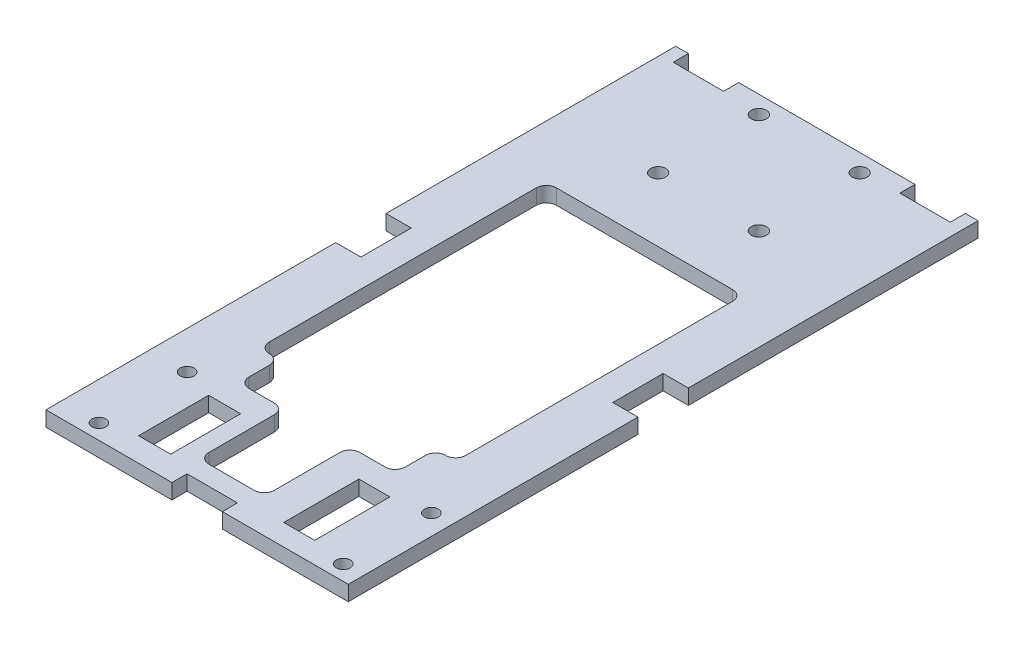
from build123d import *

# Parameters (mm, degrees)
CROQUIS1_R              = 1.5
CROQUIS1_R_2            = 1.375
CROQUIS1_W              = 6.357227068
CROQUIS1_H              = 13.910539406
CROQUIS1_W_2            = 6.149922685
CROQUIS1_H_2            = 14.93552652
SALIENTE_EXTRUIR1_DEPTH = 3


with BuildPart() as part:
    # Croquis1 → Saliente-Extruir1 (new body)
    with BuildSketch(Plane(origin=(0, 0, 0), x_dir=(1, 0, 0), z_dir=(0, 1, 0))):
        Polygon((0, 0), (25, 0), (25, 3), (35, 3), (35, 0), (60, 0), (60, 57.5), (55, 57.5), (55, 67.5), (60, 67.5), (60, 125), (57.5, 125), (57.5, 122), (47.5, 122), (47.5, 125), (12.5, 125), (12.5, 122), (2.5, 122), (2.5, 125), (0, 125), (0, 67.5), (5, 67.5), (5, 57.5), (0, 57.5), align=None)
        with Locations(Location((20, 101.5, 0), (0, 0, 270))):
            Circle(CROQUIS1_R, mode=Mode.SUBTRACT)
        with Locations(Location((20, 121.5, 0), (0, 0, 270))):
            Circle(CROQUIS1_R, mode=Mode.SUBTRACT)
        with Locations(Location((40, 121.5, 0), (0, 0, 270))):
            Circle(CROQUIS1_R, mode=Mode.SUBTRACT)
        with Locations(Location((40, 101.5, 0), (0, 0, 270))):
            Circle(CROQUIS1_R, mode=Mode.SUBTRACT)
        with Locations(Location((7.5, 3, 0), (0, 0, 270))):
            Circle(CROQUIS1_R_2, mode=Mode.SUBTRACT)
        with Locations(Location((7.5, 20.5, 0), (0, 0, 270))):
            Circle(CROQUIS1_R_2, mode=Mode.SUBTRACT)
        with Locations(Location((56, 20.5, 0), (0, 0, 270))):
            Circle(CROQUIS1_R_2, mode=Mode.SUBTRACT)
        with Locations(Location((56, 3, 0), (0, 0, 270))):
            Circle(CROQUIS1_R_2, mode=Mode.SUBTRACT)
        with Locations((16.821386466, 11.689804861)):
            Rectangle(CROQUIS1_W, CROQUIS1_H, mode=Mode.SUBTRACT)
        with Locations((46.033519219, 11.689804861)):
            Rectangle(CROQUIS1_W_2, CROQUIS1_H_2, mode=Mode.SUBTRACT)
        with BuildLine():
            Line((10.5, 33.818022813), (10.5, 86.818022813))
            ThreePointArc((10.5, 86.818022813), (11.085786438, 88.232236376), (12.5, 88.818022813))
            Line((12.5, 88.818022813), (47.5, 88.818022813))
            ThreePointArc((47.5, 88.818022813), (48.914213562, 88.232236376), (49.5, 86.818022813))
            Line((49.5, 86.818022813), (49.5, 33.818022813))
            ThreePointArc((49.5, 33.818022813), (48.914213562, 32.403809251), (47.5, 31.818022813))
            ThreePointArc((47.5, 31.818022813), (46.085786438, 31.232236376), (45.5, 29.818022813))
            Line((45.5, 29.818022813), (45.5, 25.818022813))
            ThreePointArc((45.5, 25.818022813), (44.914213562, 24.403809251), (43.5, 23.818022813))
            Line((43.5, 23.818022813), (38.5, 23.818022813))
            ThreePointArc((38.5, 23.818022813), (37.085786438, 23.232236376), (36.5, 21.818022813))
            Line((36.5, 21.818022813), (36.5, 8.818022813))
            ThreePointArc((36.5, 8.818022813), (35.914213562, 7.403809251), (34.5, 6.818022813))
            Line((34.5, 6.818022813), (25.5, 6.818022813))
            ThreePointArc((25.5, 6.818022813), (24.085786438, 7.403809251), (23.5, 8.818022813))
            Line((23.5, 8.818022813), (23.5, 21.818022813))
            ThreePointArc((23.5, 21.818022813), (22.914213562, 23.232236376), (21.5, 23.818022813))
            Line((21.5, 23.818022813), (16.5, 23.818022813))
            ThreePointArc((16.5, 23.818022813), (15.085786438, 24.403809251), (14.5, 25.818022813))
            Line((14.5, 25.818022813), (14.5, 29.818022813))
            ThreePointArc((14.5, 29.818022813), (13.914213562, 31.232236376), (12.5, 31.818022813))
            ThreePointArc((12.5, 31.818022813), (11.085786438, 32.403809251), (10.5, 33.818022813))
        make_face(mode=Mode.SUBTRACT)
    extrude(amount=SALIENTE_EXTRUIR1_DEPTH)


solid = part.part
